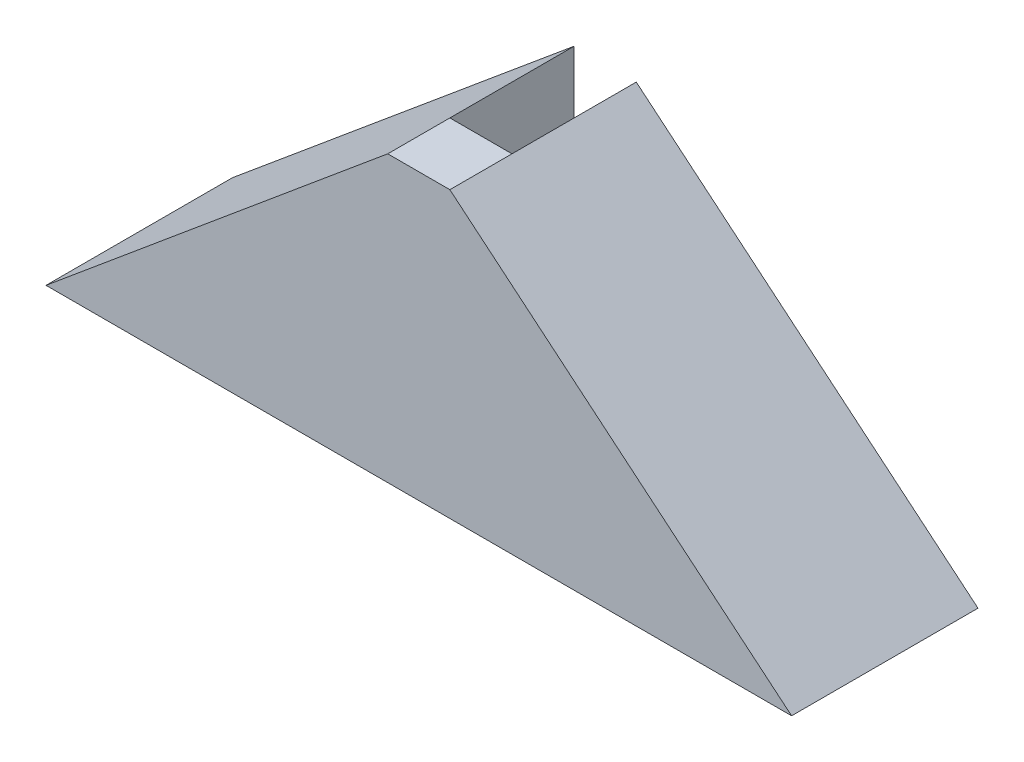
from build123d import *

# Parameters (mm, degrees)
BOSS_EXTRUDE1_DEPTH     = 7.62
SKETCH5_W               = 2.54
SKETCH5_H               = 12.7
CUT_EXTRUDE2_DEPTH      = 5.08
CUT_EXTRUDE3_DEPTH      = 34.408483952
CUT_EXTRUDE3_DEPTH_BACK = 34.408483952
SKETCH6_W               = 2.54
SKETCH6_H               = 1.058333333


with BuildPart() as part:
    # Sketch2 → Boss-Extrude1 (new body)
    with BuildSketch(Plane.XY):
        Polygon((0, 0), (-30.48, 0), (-15.24, 12.7), align=None)
    extrude(amount=BOSS_EXTRUDE1_DEPTH)

    # Sketch5 → Cut-Extrude2 (cut)
    with BuildSketch(Plane(origin=(0, 0, 0), x_dir=(-1, 0, 0), z_dir=(0, 0, -1))):
        with Locations((15.24, 6.35)):
            Rectangle(SKETCH5_W, SKETCH5_H)
    extrude(amount=-CUT_EXTRUDE2_DEPTH, mode=Mode.SUBTRACT)

    # Sketch6 → Cut-Extrude3 (cut, two sides: drawn at the far end of the back side and taken through both)
    with BuildSketch(Plane(origin=(0, 0, 5.08), x_dir=(-1, 0, 0), z_dir=(0, 0, -1)).offset(-CUT_EXTRUDE3_DEPTH_BACK)):
        with Locations((15.24, 12.170833334)):
            Rectangle(SKETCH6_W, SKETCH6_H)
    extrude(amount=CUT_EXTRUDE3_DEPTH + CUT_EXTRUDE3_DEPTH_BACK, mode=Mode.SUBTRACT)


solid = part.part
